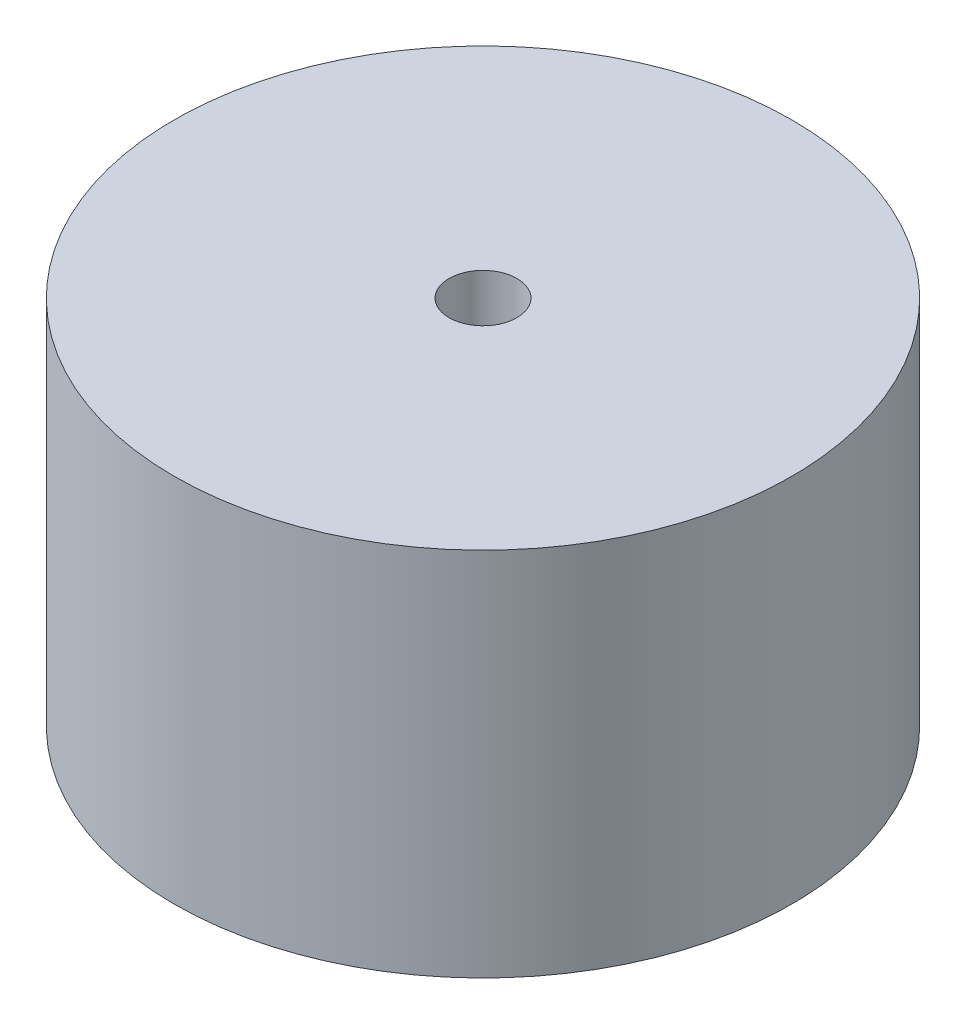
from build123d import *

# Parameters (mm, degrees)
ESBO_O1_R                = 50
ESBO_O1_R_2              = 5.5
RESSALTO_EXTRUS_O1_DEPTH = 60


with BuildPart() as part:
    # Esboço1 → Ressalto-extrusão1 (new body)
    with BuildSketch(Plane(origin=(0, 0, 0), x_dir=(1, 0, 0), z_dir=(0, 1, 0))):
        with Locations(Location((0, 0, 0), (0, 0, 270))):
            Circle(ESBO_O1_R)
        with Locations(Location((0, 0, 0), (0, 0, 270))):
            Circle(ESBO_O1_R_2, mode=Mode.SUBTRACT)
    extrude(amount=RESSALTO_EXTRUS_O1_DEPTH)


solid = part.part
